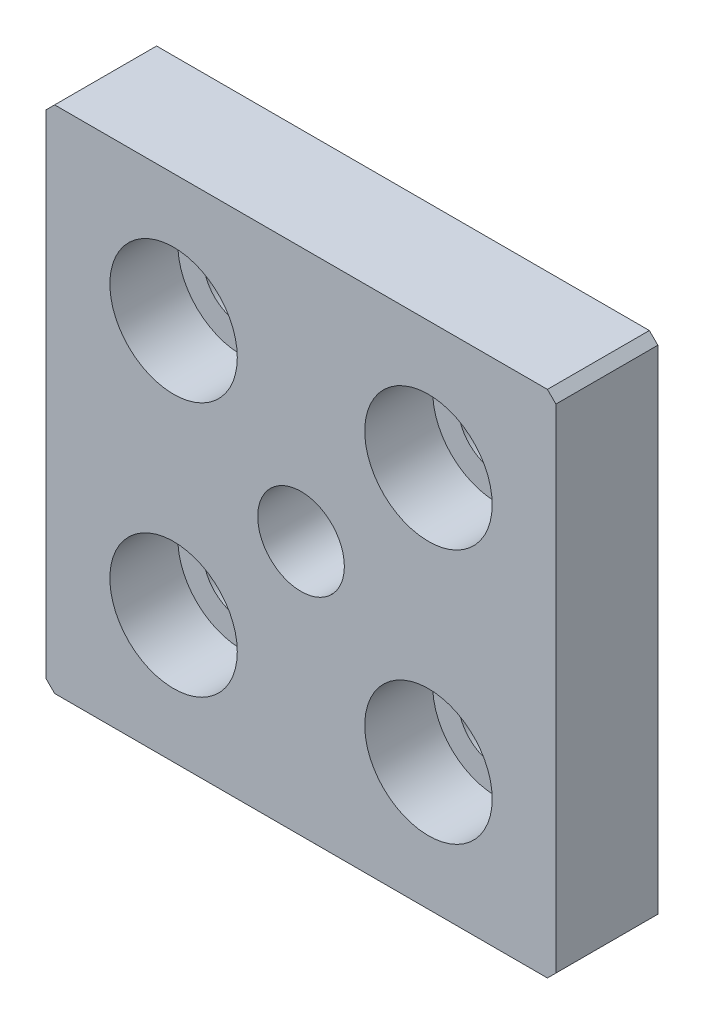
from build123d import *

# Parameters (mm, degrees)
SKETCH1_W                      = 60
SKETCH1_H                      = 60
BOSS_EXTRUDE1_DEPTH            = 12
M12X1_75_TAPPED_HOLE1_D        = 10.2
CBORE_FOR_M8_SHCS1_D           = 9
CBORE_FOR_M8_SHCS1_CBORE_D     = 15
CBORE_FOR_M8_SHCS1_CBORE_DEPTH = 8
CHAMFER1_SIZE                  = 1


with BuildPart() as part:
    # Sketch1 → Boss-Extrude1 (new body)
    with BuildSketch(Plane.XY):
        Rectangle(SKETCH1_W, SKETCH1_H)
    extrude(amount=BOSS_EXTRUDE1_DEPTH)

    # M12x1.75 Tapped Hole1 (through all)
    with Locations(Plane.XY.offset(12)):
        with Locations((0, 0)):
            Hole(M12X1_75_TAPPED_HOLE1_D / 2)

    # CBORE for M8 SHCS1 (through all)
    with Locations(Plane.XY.offset(12)):
        with Locations((-15, 15), (15, 15), (15, -15), (-15, -15)):
            CounterBoreHole(CBORE_FOR_M8_SHCS1_D / 2, CBORE_FOR_M8_SHCS1_CBORE_D / 2, CBORE_FOR_M8_SHCS1_CBORE_DEPTH)

    # Chamfer1
    chamfer1_edges = [part.edges().sort_by_distance(p)[0] for p in [
        (30, -30, 6),
        (-30, -30, 6),
        (-30, 30, 6),
        (30, 30, 6),
    ]]
    chamfer(chamfer1_edges, length=CHAMFER1_SIZE)


solid = part.part
